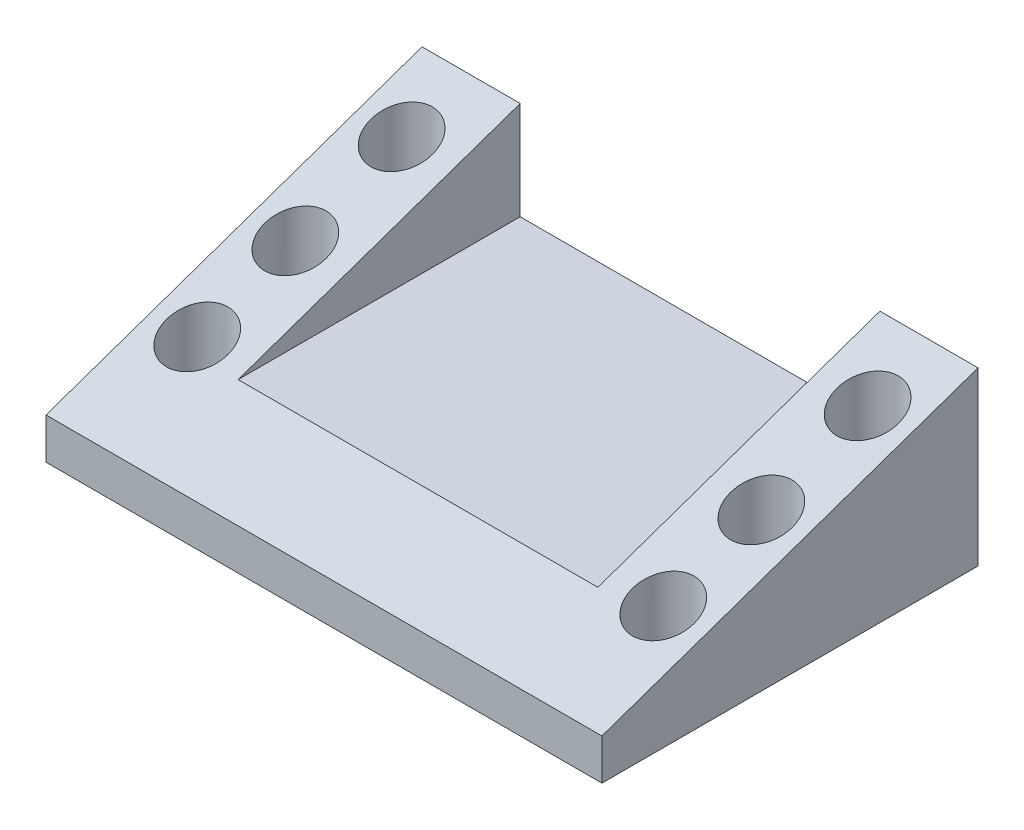
from build123d import *

# Parameters (mm, degrees)
SKETCH1_W           = 68
SKETCH1_H           = 46
BOSS_EXTRUDE1_DEPTH = 67
SKETCH3_W           = 44
SKETCH3_H           = 46
CUT_EXTRUDE2_DEPTH  = 58
CUT_EXTRUDE1_REACH  = 100.194
CUT_EXTRUDE3_REACH  = 48.109
SKETCH4_R           = 3.75


with BuildPart() as part:
    # Sketch1 → Boss-Extrude1 (new body)
    with BuildSketch(Plane(origin=(0, 0, 0), x_dir=(1, 0, 0), z_dir=(0, 1, 0))):
        Rectangle(SKETCH1_W, SKETCH1_H)
    extrude(amount=BOSS_EXTRUDE1_DEPTH)

    # Sketch3 → Cut-Extrude2 (cut)
    with BuildSketch(Plane(origin=(0, 67, 0), x_dir=(1, 0, 0), z_dir=(0, 1, 0))):
        Rectangle(SKETCH3_W, SKETCH3_H)
    extrude(amount=-CUT_EXTRUDE2_DEPTH, mode=Mode.SUBTRACT)

    # Cut-Extrude1: up to this face of the body (flat: up to its plane)
    cut_extrude1_end = Plane(part.part.faces().sort_by_distance((-34, 33.5, 0))[0])
    # Sketch2 → Cut-Extrude1 (cut, up to the picked face)
    with BuildSketch(Plane(origin=(34, 0, 0), x_dir=(0, 0, -1), z_dir=(1, 0, 0)), mode=Mode.PRIVATE) as cut_extrude1_sk1:
        Polygon((-23, 5), (23, 21), (23, 67), (-23, 67), align=None)
    cut_extrude1_tool1 = split(extrude(cut_extrude1_sk1.sketch, amount=-CUT_EXTRUDE1_REACH, mode=Mode.PRIVATE), bisect_by=cut_extrude1_end, keep=Keep.BOTH, mode=Mode.PRIVATE)
    add(cut_extrude1_tool1.solids().sort_by(Axis((34, 39.802469, 1.135802), (-1, 0, 0)))[0], mode=Mode.SUBTRACT)

    # Cut-Extrude3: up to this plane
    cut_extrude3_end = Plane(origin=(-111.201036262, 5, 23), z_dir=(0, -0.9444967967061592, -0.32852062494127277))
    # Sketch4 → Cut-Extrude3 (cut, up to the surface)
    with BuildSketch(Plane(origin=(0, 0, 0), x_dir=(-1, 0, 0), z_dir=(0, -1, 0)), mode=Mode.PRIVATE) as cut_extrude3_sk1:
        with Locations(Location((-28.5, 15, 0), (0, 0, 90))):
            Circle(SKETCH4_R)
    cut_extrude3_tool1 = split(extrude(cut_extrude3_sk1.sketch, amount=-CUT_EXTRUDE3_REACH, mode=Mode.PRIVATE), bisect_by=cut_extrude3_end, keep=Keep.BOTH, mode=Mode.PRIVATE)
    add(cut_extrude3_tool1.solids().sort_by_distance((28.5, 0, -15))[0], mode=Mode.SUBTRACT)
    # Sketch4 → Cut-Extrude3 (cut, up to the surface)
    with BuildSketch(Plane(origin=(0, 0, 0), x_dir=(-1, 0, 0), z_dir=(0, -1, 0)), mode=Mode.PRIVATE) as cut_extrude3_sk2:
        with Locations(Location((-28.5, 2, 0), (0, 0, 90))):
            Circle(SKETCH4_R)
    cut_extrude3_tool2 = split(extrude(cut_extrude3_sk2.sketch, amount=-CUT_EXTRUDE3_REACH, mode=Mode.PRIVATE), bisect_by=cut_extrude3_end, keep=Keep.BOTH, mode=Mode.PRIVATE)
    add(cut_extrude3_tool2.solids().sort_by_distance((28.5, 0, -2))[0], mode=Mode.SUBTRACT)
    # Sketch4 → Cut-Extrude3 (cut, up to the surface)
    with BuildSketch(Plane(origin=(0, 0, 0), x_dir=(-1, 0, 0), z_dir=(0, -1, 0)), mode=Mode.PRIVATE) as cut_extrude3_sk3:
        with Locations(Location((-28.5, -10, 0), (0, 0, 90))):
            Circle(SKETCH4_R)
    cut_extrude3_tool3 = split(extrude(cut_extrude3_sk3.sketch, amount=-CUT_EXTRUDE3_REACH, mode=Mode.PRIVATE), bisect_by=cut_extrude3_end, keep=Keep.BOTH, mode=Mode.PRIVATE)
    add(cut_extrude3_tool3.solids().sort_by_distance((28.5, 0, 10))[0], mode=Mode.SUBTRACT)
    # Sketch4 → Cut-Extrude3 (cut, up to the surface)
    with BuildSketch(Plane(origin=(0, 0, 0), x_dir=(-1, 0, 0), z_dir=(0, -1, 0)), mode=Mode.PRIVATE) as cut_extrude3_sk4:
        with Locations(Location((28.5, 15, 0), (0, 0, 90))):
            Circle(SKETCH4_R)
    cut_extrude3_tool4 = split(extrude(cut_extrude3_sk4.sketch, amount=-CUT_EXTRUDE3_REACH, mode=Mode.PRIVATE), bisect_by=cut_extrude3_end, keep=Keep.BOTH, mode=Mode.PRIVATE)
    add(cut_extrude3_tool4.solids().sort_by_distance((-28.5, 0, -15))[0], mode=Mode.SUBTRACT)
    # Sketch4 → Cut-Extrude3 (cut, up to the surface)
    with BuildSketch(Plane(origin=(0, 0, 0), x_dir=(-1, 0, 0), z_dir=(0, -1, 0)), mode=Mode.PRIVATE) as cut_extrude3_sk5:
        with Locations(Location((28.5, 2, 0), (0, 0, 90))):
            Circle(SKETCH4_R)
    cut_extrude3_tool5 = split(extrude(cut_extrude3_sk5.sketch, amount=-CUT_EXTRUDE3_REACH, mode=Mode.PRIVATE), bisect_by=cut_extrude3_end, keep=Keep.BOTH, mode=Mode.PRIVATE)
    add(cut_extrude3_tool5.solids().sort_by_distance((-28.5, 0, -2))[0], mode=Mode.SUBTRACT)
    # Sketch4 → Cut-Extrude3 (cut, up to the surface)
    with BuildSketch(Plane(origin=(0, 0, 0), x_dir=(-1, 0, 0), z_dir=(0, -1, 0)), mode=Mode.PRIVATE) as cut_extrude3_sk6:
        with Locations(Location((28.5, -10, 0), (0, 0, 90))):
            Circle(SKETCH4_R)
    cut_extrude3_tool6 = split(extrude(cut_extrude3_sk6.sketch, amount=-CUT_EXTRUDE3_REACH, mode=Mode.PRIVATE), bisect_by=cut_extrude3_end, keep=Keep.BOTH, mode=Mode.PRIVATE)
    add(cut_extrude3_tool6.solids().sort_by_distance((-28.5, 0, 10))[0], mode=Mode.SUBTRACT)


solid = part.part
